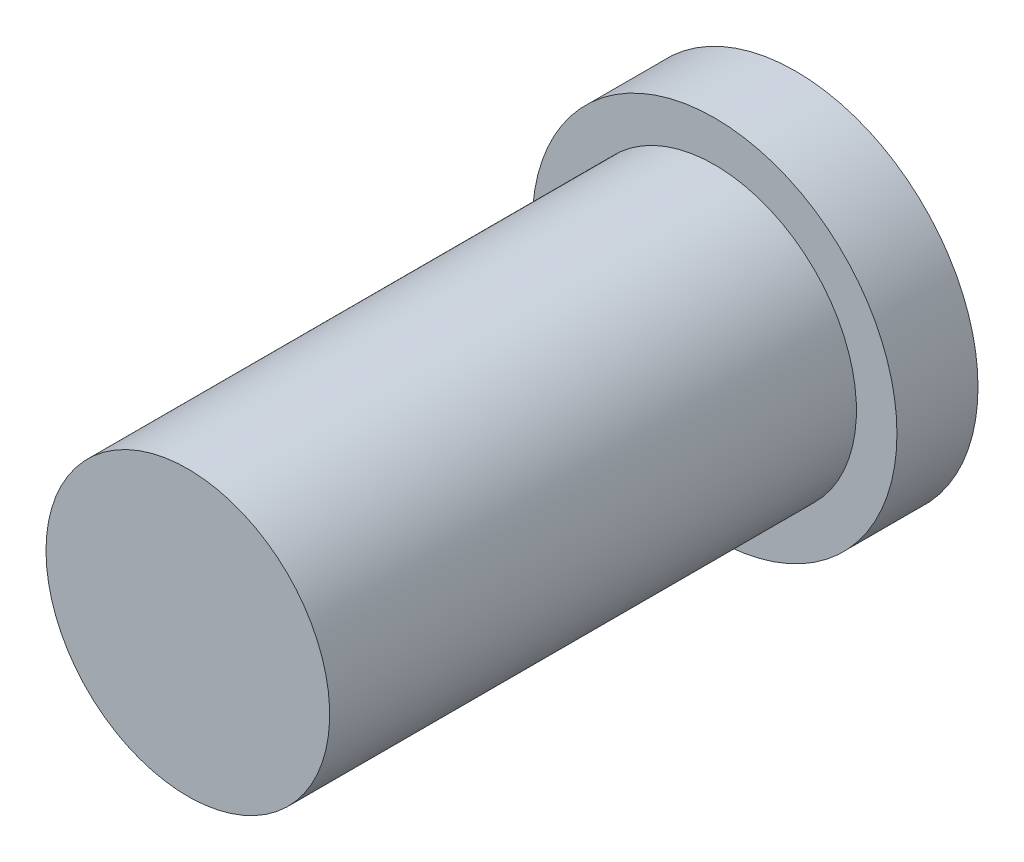
from build123d import *

# Parameters (mm, degrees)
SKETCH1_R           = 4.5
BOSS_EXTRUDE1_DEPTH = 2
SKETCH2_R           = 3.5
BOSS_EXTRUDE2_DEPTH = 13


with BuildPart() as part:
    # Sketch1 → Boss-Extrude1 (new body)
    with BuildSketch(Plane.XY):
        Circle(SKETCH1_R)
    extrude(amount=BOSS_EXTRUDE1_DEPTH)

    # Sketch2 → Boss-Extrude2 (add)
    with BuildSketch(Plane.XY.offset(2)):
        with Locations(Location((0, 0, 0), (0, 0, 180))):
            Circle(SKETCH2_R)
    extrude(amount=BOSS_EXTRUDE2_DEPTH)


solid = part.part
